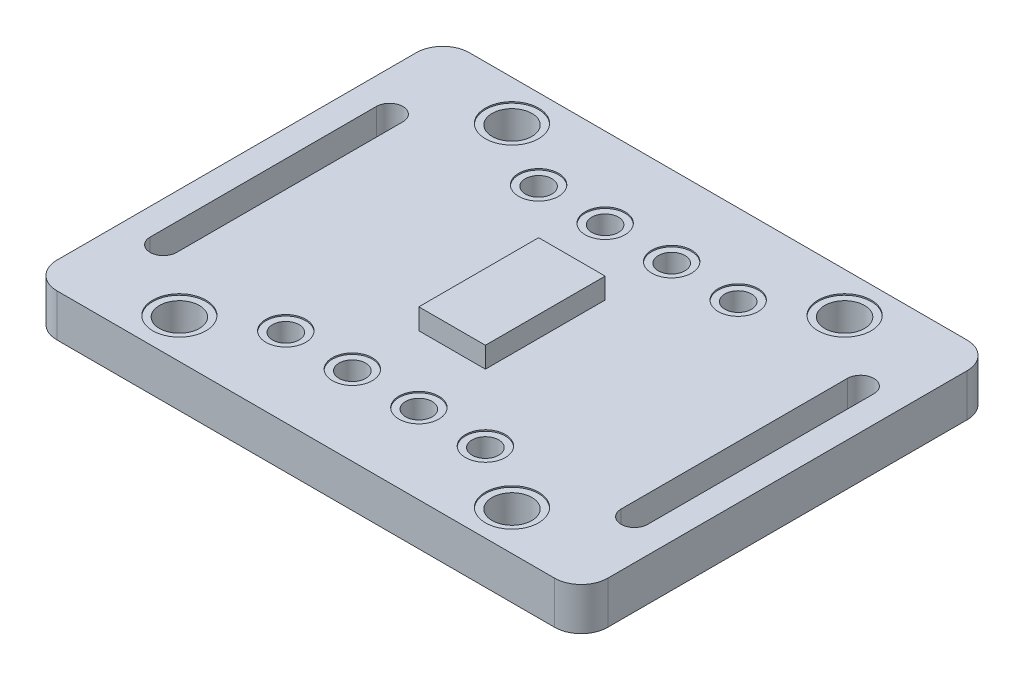
from build123d import *

# Parameters (mm, degrees)
SKETCH1_W           = 20.7
SKETCH1_H           = 15.5
BOSS_EXTRUDE1_DEPTH = 1.6
FILLET1_R           = 1
SKETCH2_R           = 0.75
SKETCH2_R_2         = 0.5
CUT_EXTRUDE1_DEPTH  = 14.028622337
SKETCH2_3_R         = 1
SKETCH2_3_R_2       = 0.75
SKETCH2_3_R_3       = 0.5
CUT_EXTRUDE3_DEPTH  = 0.05
CUT_EXTRUDE2_DEPTH  = 14.028622337
SKETCH4_W           = 2.5
SKETCH4_H           = 4.5
BOSS_EXTRUDE2_DEPTH = 0.78


with BuildPart() as part:
    # Sketch1 → Boss-Extrude1 (new body)
    with BuildSketch(Plane(origin=(0, 0, 0), x_dir=(1, 0, 0), z_dir=(0, 1, 0))):
        Rectangle(SKETCH1_W, SKETCH1_H)
    extrude(amount=BOSS_EXTRUDE1_DEPTH)

    # Fillet1
    fillet1_edges = [part.edges().sort_by_distance(p)[0] for p in [
        (-10.35, 0.8, -7.75),
        (-10.35, 0.8, 7.75),
        (10.35, 0.8, -7.75),
        (10.35, 0.8, 7.75),
    ]]
    fillet(fillet1_edges, radius=FILLET1_R)

    # Sketch2 → Cut-Extrude1 (cut, through all)
    with BuildSketch(Plane(origin=(0, 1.6, 0), x_dir=(1, 0, 0), z_dir=(0, 1, 0))):
        with Locations((-6.25, -6.25)):
            Circle(SKETCH2_R)
        with Locations((-3.75, -4.75)):
            Circle(SKETCH2_R_2)
        with Locations((-1.25, -4.75)):
            Circle(SKETCH2_R_2)
        with Locations((6.25, -6.25)):
            Circle(SKETCH2_R)
        with Locations((3.75, -4.75)):
            Circle(SKETCH2_R_2)
        with Locations((1.25, -4.75)):
            Circle(SKETCH2_R_2)
    cut_extrude1 = extrude(amount=-CUT_EXTRUDE1_DEPTH, mode=Mode.SUBTRACT)

    # Sketch2<3> → Cut-Extrude3 (cut)
    # profile 1 of 6: a face of its own
    with BuildSketch(Plane(origin=(0, 1.6, 0), x_dir=(1, 0, 0), z_dir=(0, 1, 0))):
        with Locations((-6.25, -6.25)):
            Circle(SKETCH2_3_R)
        with Locations((-6.25, -6.25)):
            Circle(SKETCH2_3_R_2, mode=Mode.SUBTRACT)
    # profile 2 of 6: a face of its own
    with BuildSketch(Plane(origin=(0, 1.6, 0), x_dir=(1, 0, 0), z_dir=(0, 1, 0))):
        with Locations((-3.75, -4.75)):
            Circle(SKETCH2_3_R_2)
        with Locations((-3.75, -4.75)):
            Circle(SKETCH2_3_R_3, mode=Mode.SUBTRACT)
    # profile 3 of 6: a face of its own
    with BuildSketch(Plane(origin=(0, 1.6, 0), x_dir=(1, 0, 0), z_dir=(0, 1, 0))):
        with Locations((-1.25, -4.75)):
            Circle(SKETCH2_3_R_2)
        with Locations((-1.25, -4.75)):
            Circle(SKETCH2_3_R_3, mode=Mode.SUBTRACT)
    # profile 4 of 6: a face of its own
    with BuildSketch(Plane(origin=(0, 1.6, 0), x_dir=(1, 0, 0), z_dir=(0, 1, 0))):
        with Locations((1.25, -4.75)):
            Circle(SKETCH2_3_R_2)
        with Locations((1.25, -4.75)):
            Circle(SKETCH2_3_R_3, mode=Mode.SUBTRACT)
    # profile 5 of 6: a face of its own
    with BuildSketch(Plane(origin=(0, 1.6, 0), x_dir=(1, 0, 0), z_dir=(0, 1, 0))):
        with Locations((3.75, -4.75)):
            Circle(SKETCH2_3_R_2)
        with Locations((3.75, -4.75)):
            Circle(SKETCH2_3_R_3, mode=Mode.SUBTRACT)
    # profile 6 of 6: a face of its own
    with BuildSketch(Plane(origin=(0, 1.6, 0), x_dir=(1, 0, 0), z_dir=(0, 1, 0))):
        with Locations((6.25, -6.25)):
            Circle(SKETCH2_3_R)
        with Locations((6.25, -6.25)):
            Circle(SKETCH2_3_R_2, mode=Mode.SUBTRACT)
    cut_extrude3 = extrude(amount=-CUT_EXTRUDE3_DEPTH, mode=Mode.SUBTRACT)

    # Mirror1: Cut-Extrude1, Cut-Extrude3 across plane
    add(cut_extrude1.mirror(Plane.XY), mode=Mode.SUBTRACT)
    add(cut_extrude3.mirror(Plane.XY), mode=Mode.SUBTRACT)

    # Sketch3 → Cut-Extrude2 (cut, through all)
    with BuildSketch(Plane(origin=(0, 1.6, 0), x_dir=(1, 0, 0), z_dir=(0, 1, 0))):
        with BuildLine():
            Line((-9.35, -4.25), (-9.35, 4.25))
            ThreePointArc((-9.35, 4.25), (-8.85, 4.75), (-8.35, 4.25))
            Line((-8.35, 4.25), (-8.35, -4.25))
            ThreePointArc((-8.35, -4.25), (-8.85, -4.75), (-9.35, -4.25))
        make_face()
    cut_extrude2 = extrude(amount=-CUT_EXTRUDE2_DEPTH, mode=Mode.SUBTRACT)

    # Mirror2: Cut-Extrude2 across plane
    add(cut_extrude2.mirror(Plane(origin=(0, 0, 0), x_dir=(0, 0, 1), z_dir=(1, 0, 0))), mode=Mode.SUBTRACT)

    # Sketch4 → Boss-Extrude2 (add)
    with BuildSketch(Plane(origin=(0, 1.6, 0), x_dir=(1, 0, 0), z_dir=(0, 1, 0))):
        Rectangle(SKETCH4_W, SKETCH4_H)
    extrude(amount=BOSS_EXTRUDE2_DEPTH)


solid = part.part
